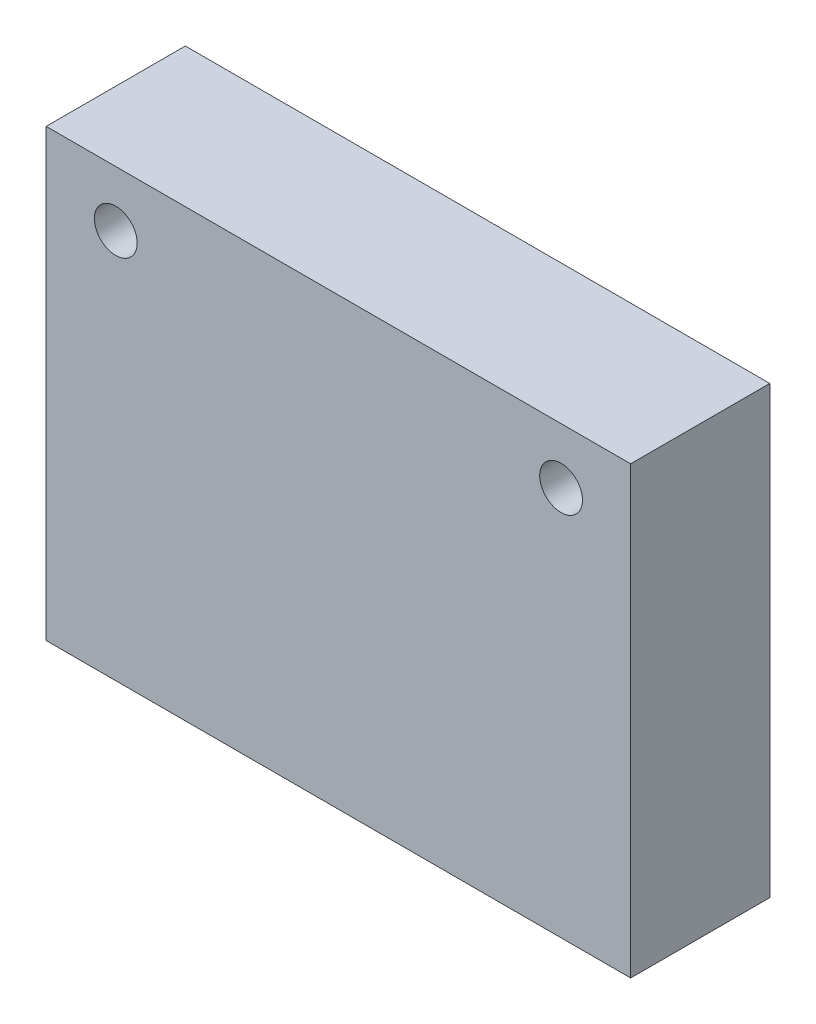
from build123d import *

# Parameters (mm, degrees)
SKETCH1_W           = 21
SKETCH1_H           = 16
SKETCH1_R           = 0.767903191
BOSS_EXTRUDE1_DEPTH = 5


with BuildPart() as part:
    # Sketch1 → Boss-Extrude1 (new body)
    with BuildSketch(Plane(origin=(0, 0, 0), x_dir=(-1, 0, 0), z_dir=(0, 0, -1))):
        Rectangle(SKETCH1_W, SKETCH1_H)
        with Locations(Location((-8, 6, 0), (0, 0, 180))):
            Circle(SKETCH1_R, mode=Mode.SUBTRACT)
        with Locations(Location((8, 6, 0), (0, 0, 180))):
            Circle(SKETCH1_R, mode=Mode.SUBTRACT)
    extrude(amount=-BOSS_EXTRUDE1_DEPTH)


solid = part.part
